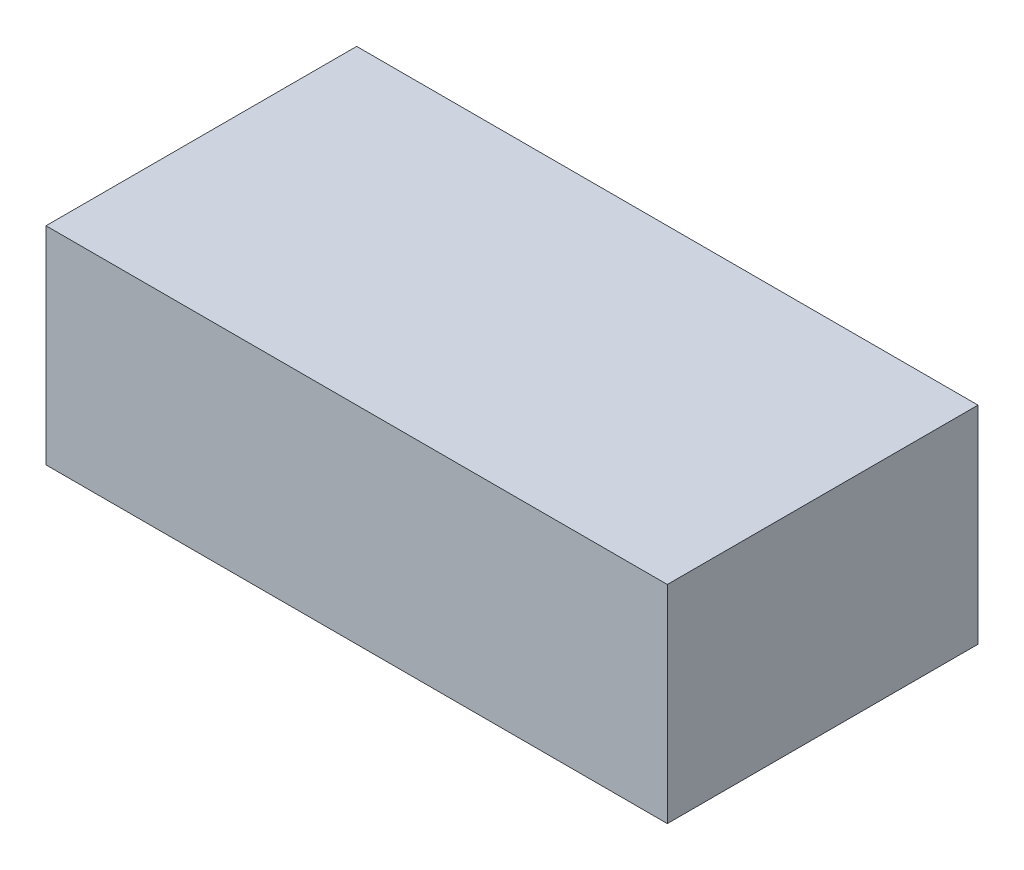
from build123d import *

# Parameters (mm, degrees)
SKETCH2_W           = 38.1
SKETCH2_H           = 19.05
BOSS_EXTRUDE1_DEPTH = 12.7


with BuildPart() as part:
    # Sketch2 → Boss-Extrude1 (new body)
    with BuildSketch(Plane(origin=(0, 0, 0), x_dir=(1, 0, 0), z_dir=(0, 1, 0))):
        with Locations((3.257826087, 3.230217391)):
            Rectangle(SKETCH2_W, SKETCH2_H)
    extrude(amount=BOSS_EXTRUDE1_DEPTH)


solid = part.part
